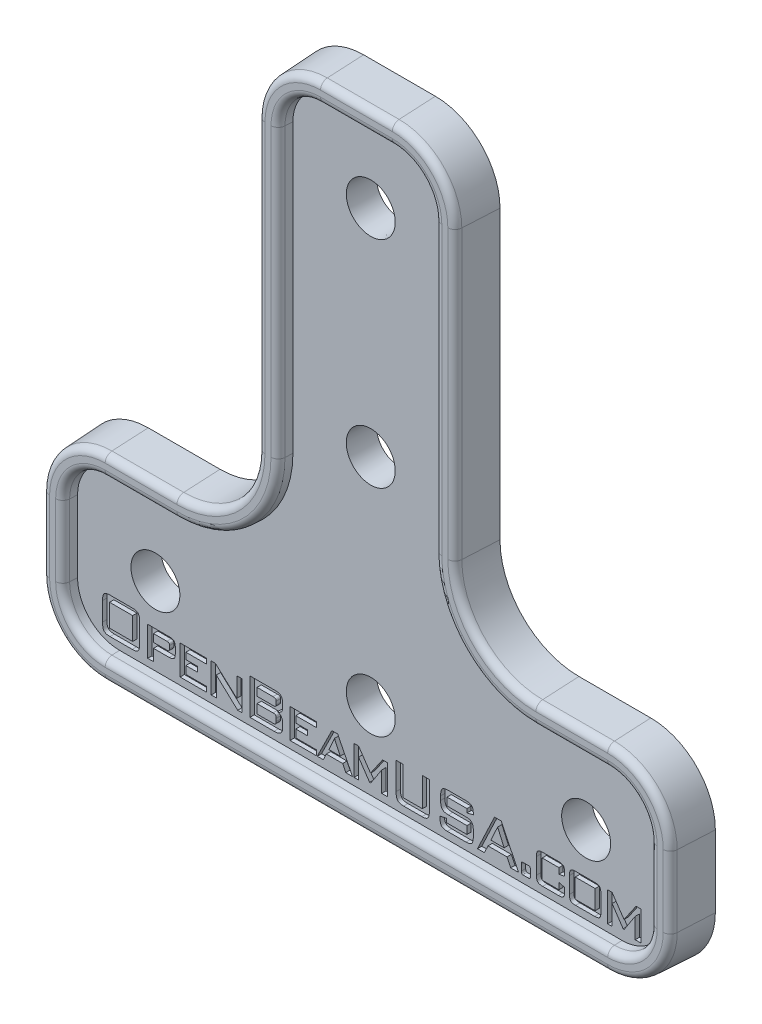
from build123d import *

# Parameters (mm, degrees)
BOSS_EXTRUDE1_DEPTH = 2
FILLET1_R           = 5
SKETCH2_R           = 1.6
CUT_EXTRUDE1_DEPTH  = 38.553295461
MOVE_FACE1_BY       = 0.5
MOVE_FACE1_2_BY     = 0.5
MOVE_FACE1_3_BY     = 0.5
MOVE_FACE1_4_BY     = 0.5
MOVE_FACE1_5_BY     = 0.5
MOVE_FACE1_6_BY     = 0.5
MOVE_FACE1_7_BY     = 0.5
MOVE_FACE1_8_BY     = 0.5
MOVE_FACE1_9_BY     = 0.5
MOVE_FACE1_10_BY    = 0.5
MOVE_FACE1_11_BY    = 0.5
MOVE_FACE1_12_BY    = 0.5
MOVE_FACE1_13_BY    = 0.5
MOVE_FACE1_14_BY    = 0.5
MOVE_FACE1_15_BY    = 0.5
MOVE_FACE1_16_BY    = 0.5
DRAFT1_ANGLE        = -3
BOSS_EXTRUDE3_DEPTH = 1
BOSS_EXTRUDE3_DRAFT = 3
FILLET3_R           = 0.5
CUT_EXTRUDE2_DEPTH  = 0.2
CUT_EXTRUDE2_DRAFT  = -3
SKETCH6_W           = 1.607142857
SKETCH6_H           = 1.5625
SKETCH6_W_2         = 1.383928571
SKETCH6_H_2         = 1.339285714
CUT_EXTRUDE3_DEPTH  = 0.3


with BuildPart() as part:
    # Sketch1 → Boss-Extrude1 (new body)
    with BuildSketch(Plane.XY):
        Polygon((-7.5, 30), (7.5, 30), (7.5, 0), (22.5, 0), (22.5, -15), (-22.5, -15), (-22.5, 0), (-7.5, 0), align=None)
    extrude(amount=BOSS_EXTRUDE1_DEPTH)

    # Fillet1
    fillet1_edges = [part.edges().sort_by_distance(p)[0] for p in [
        (-7.5, 30, 1),
        (7.5, 30, 1),
        (7.5, 0, 1),
        (22.5, 0, 1),
        (22.5, -15, 1),
        (-22.5, -15, 1),
        (-22.5, 0, 1),
        (-7.5, 0, 1),
    ]]
    fillet(fillet1_edges, radius=FILLET1_R)

    # Sketch2 → Cut-Extrude1 (cut, through all)
    with BuildSketch(Plane.XY.offset(2)):
        with Locations((-15, -7.5)):
            Circle(SKETCH2_R)
        with Locations((0, -7.5)):
            Circle(SKETCH2_R)
        with Locations((15, -7.5)):
            Circle(SKETCH2_R)
        with Locations((0, 22.5)):
            Circle(SKETCH2_R)
        with Locations((0, 7.5)):
            Circle(SKETCH2_R)
    extrude(amount=-CUT_EXTRUDE1_DEPTH, mode=Mode.SUBTRACT)

    # Move Face1: a curved face moved inward by 0.5
    add(Solid.thicken(part.faces().sort_by_distance((-8.964466094, 1.464466094, 1))[0], -MOVE_FACE1_BY), mode=Mode.SUBTRACT)

    # Move Face1 2: a face moved inward by 0.5
    extrude(part.faces().sort_by_distance((-15, 0, 1))[0], amount=MOVE_FACE1_2_BY, dir=(0, -1, 0), mode=Mode.SUBTRACT)

    # Move Face1 3: a curved face moved inward by 0.5
    add(Solid.thicken(part.faces().sort_by_distance((-21.035533906, -1.464466094, 1))[0], -MOVE_FACE1_3_BY), mode=Mode.SUBTRACT)

    # Move Face1 4: a face moved inward by 0.5
    extrude(part.faces().sort_by_distance((-22.5, -7.5, 1))[0], amount=MOVE_FACE1_4_BY, dir=(1, 0, 0), mode=Mode.SUBTRACT)

    # Move Face1 5: a curved face moved inward by 0.5
    add(Solid.thicken(part.faces().sort_by_distance((-21.035533906, -13.535533906, 1))[0], -MOVE_FACE1_5_BY), mode=Mode.SUBTRACT)

    # Move Face1 6: a face moved inward by 0.5
    extrude(part.faces().sort_by_distance((0, -15, 1))[0], amount=MOVE_FACE1_6_BY, dir=(0, 1, 0), mode=Mode.SUBTRACT)

    # Move Face1 7: a curved face moved inward by 0.5
    add(Solid.thicken(part.faces().sort_by_distance((21.035533906, -13.535533906, 1))[0], -MOVE_FACE1_7_BY), mode=Mode.SUBTRACT)

    # Move Face1 8: a face moved inward by 0.5
    extrude(part.faces().sort_by_distance((22.5, -7.5, 1))[0], amount=MOVE_FACE1_8_BY, dir=(-1, 0, 0), mode=Mode.SUBTRACT)

    # Move Face1 9: a curved face moved inward by 0.5
    add(Solid.thicken(part.faces().sort_by_distance((21.035533906, -1.464466094, 1))[0], -MOVE_FACE1_9_BY), mode=Mode.SUBTRACT)

    # Move Face1 10: a face moved inward by 0.5
    extrude(part.faces().sort_by_distance((15, 0, 1))[0], amount=MOVE_FACE1_10_BY, dir=(0, -1, 0), mode=Mode.SUBTRACT)

    # Move Face1 11: a curved face moved inward by 0.5
    add(Solid.thicken(part.faces().sort_by_distance((8.964466094, 1.464466094, 1))[0], -MOVE_FACE1_11_BY), mode=Mode.SUBTRACT)

    # Move Face1 12: a face moved inward by 0.5
    extrude(part.faces().sort_by_distance((7.5, 15, 1))[0], amount=MOVE_FACE1_12_BY, dir=(-1, 0, 0), mode=Mode.SUBTRACT)

    # Move Face1 13: a curved face moved inward by 0.5
    add(Solid.thicken(part.faces().sort_by_distance((6.035533906, 28.535533906, 1))[0], -MOVE_FACE1_13_BY), mode=Mode.SUBTRACT)

    # Move Face1 14: a face moved inward by 0.5
    extrude(part.faces().sort_by_distance((0, 30, 1))[0], amount=MOVE_FACE1_14_BY, dir=(0, -1, 0), mode=Mode.SUBTRACT)

    # Move Face1 15: a curved face moved inward by 0.5
    add(Solid.thicken(part.faces().sort_by_distance((-6.035533906, 28.535533906, 1))[0], -MOVE_FACE1_15_BY), mode=Mode.SUBTRACT)

    # Move Face1 16: a face moved inward by 0.5
    extrude(part.faces().sort_by_distance((-7.5, 15, 1))[0], amount=MOVE_FACE1_16_BY, dir=(1, 0, 0), mode=Mode.SUBTRACT)

    # Draft1
    draft1_faces = [part.faces().sort_by_distance(p)[0] for p in [
        (13.4, -7.5, 1),
        (-1.6, 22.5, 1),
        (-1.6, 7.5, 1),
        (-1.6, -7.5, 1),
        (-16.6, -7.5, 1),
        (-20.681980515, -1.818019485, 1),
        (-22, -7.5, 1),
        (-20.681980515, -13.181980515, 1),
        (0, -14.5, 1),
        (20.681980515, -13.181980515, 1),
        (22, -7.5, 1),
        (20.681980515, -1.818019485, 1),
        (15, -0.5, 1),
        (8.610912703, 1.110912703, 1),
        (7, 15, 1),
        (5.681980515, 28.181980515, 1),
        (0, 29.5, 1),
        (-5.681980515, 28.181980515, 1),
        (-7, 15, 1),
        (-8.610912703, 1.110912703, 1),
        (-15, -0.5, 1),
    ]]
    draft(draft1_faces, Plane(origin=(0, 0, 0), x_dir=(-1, 0, 0), z_dir=(0, 0, -1)), DRAFT1_ANGLE)


with BuildPart() as boss_extrude3_tool:
    # Sketch4 → Boss-Extrude3 (with draft: the straight prism first)
    with BuildSketch(Plane.XY.offset(2)):
        with BuildLine():
            Line((-17.5, -14.395184441), (17.5, -14.395184441))
            ThreePointArc((17.5, -14.395184441), (20.607864723, -13.107864723), (21.895184441, -10))
            Line((21.895184441, -10), (21.895184441, -5))
            ThreePointArc((21.895184441, -5), (20.607864723, -1.892135277), (17.5, -0.604815559))
            Line((17.5, -0.604815559), (12.5, -0.604815559))
            ThreePointArc((12.5, -0.604815559), (8.536796911, 1.036796911), (6.895184441, 5))
            Line((6.895184441, 5), (6.895184441, 25))
            ThreePointArc((6.895184441, 25), (5.607864723, 28.107864723), (2.5, 29.395184441))
            Line((2.5, 29.395184441), (-2.5, 29.395184441))
            ThreePointArc((-2.5, 29.395184441), (-5.607864723, 28.107864723), (-6.895184441, 25))
            Line((-6.895184441, 25), (-6.895184441, 5))
            ThreePointArc((-6.895184441, 5), (-8.536796911, 1.036796911), (-12.5, -0.604815559))
            Line((-12.5, -0.604815559), (-17.5, -0.604815559))
            ThreePointArc((-17.5, -0.604815559), (-20.607864723, -1.892135277), (-21.895184441, -5))
            Line((-21.895184441, -5), (-21.895184441, -10))
            ThreePointArc((-21.895184441, -10), (-20.607864723, -13.107864723), (-17.5, -14.395184441))
        make_face()
        with BuildLine():
            Line((-17.5, -12.921388331), (17.5, -12.921388331))
            ThreePointArc((17.5, -12.921388331), (19.565733499, -12.065733499), (20.421388331, -10))
            Line((20.421388331, -10), (20.421388331, -5))
            ThreePointArc((20.421388331, -5), (19.565733499, -2.934266501), (17.5, -2.078611669))
            Line((17.5, -2.078611669), (12.5, -2.078611669))
            ThreePointArc((12.5, -2.078611669), (7.494665688, -0.005334312), (5.421388331, 5))
            Line((5.421388331, 5), (5.421388331, 25))
            ThreePointArc((5.421388331, 25), (4.565733499, 27.065733499), (2.5, 27.921388331))
            Line((2.5, 27.921388331), (-2.5, 27.921388331))
            ThreePointArc((-2.5, 27.921388331), (-4.565733499, 27.065733499), (-5.421388331, 25))
            Line((-5.421388331, 25), (-5.421388331, 5))
            ThreePointArc((-5.421388331, 5), (-7.494665688, -0.005334312), (-12.5, -2.078611669))
            Line((-12.5, -2.078611669), (-17.5, -2.078611669))
            ThreePointArc((-17.5, -2.078611669), (-19.565733499, -2.934266501), (-20.421388331, -5))
            Line((-20.421388331, -5), (-20.421388331, -10))
            ThreePointArc((-20.421388331, -10), (-19.565733499, -12.065733499), (-17.5, -12.921388331))
        make_face(mode=Mode.SUBTRACT)
    extrude(amount=BOSS_EXTRUDE3_DEPTH)
    # Boss-Extrude3: the draft: its side faces are tilted about the plane it starts from
    boss_extrude3_sides = [boss_extrude3_tool.faces().sort_by_distance(p)[0] for p in [
        (-20.607864723, -1.892135277, 2.5),
        (-21.895184441, -7.5, 2.5),
        (-20.607864723, -13.107864723, 2.5),
        (0, -14.395184441, 2.5),
        (20.607864723, -13.107864723, 2.5),
        (21.895184441, -7.5, 2.5),
        (20.607864723, -1.892135277, 2.5),
        (15, -0.604815559, 2.5),
        (8.536796911, 1.036796911, 2.5),
        (6.895184441, 15, 2.5),
        (5.607864723, 28.107864723, 2.5),
        (0, 29.395184441, 2.5),
        (-5.607864723, 28.107864723, 2.5),
        (-6.895184441, 15, 2.5),
        (-8.536796911, 1.036796911, 2.5),
        (-15, -0.604815559, 2.5),
        (-15, -2.078611669, 2.5),
        (-7.494665688, -0.005334312, 2.5),
        (-5.421388331, 15, 2.5),
        (-4.565733499, 27.065733499, 2.5),
        (0, 27.921388331, 2.5),
        (4.565733499, 27.065733499, 2.5),
        (5.421388331, 15, 2.5),
        (7.494665688, -0.005334312, 2.5),
        (15, -2.078611669, 2.5),
        (19.565733499, -2.934266501, 2.5),
        (20.421388331, -7.5, 2.5),
        (19.565733499, -12.065733499, 2.5),
        (0, -12.921388331, 2.5),
        (-19.565733499, -12.065733499, 2.5),
        (-20.421388331, -7.5, 2.5),
        (-19.565733499, -2.934266501, 2.5),
    ]]
    draft(boss_extrude3_sides, Plane.XY.offset(2), BOSS_EXTRUDE3_DRAFT)


with BuildPart() as part_1:
    add(part.part)

    # Boss-Extrude3: add boss_extrude3_tool
    add(boss_extrude3_tool.part)

    # Fillet3
    fillet3_edges = [part_1.edges().sort_by_distance(p)[0] for p in [
        (-20.570806827, -13.070806827, 3),
        (0, -14.342776662, 3),
        (20.570806827, -13.070806827, 3),
        (21.842776662, -7.5, 3),
        (20.570806827, -1.929193173, 3),
        (15, -0.657223338, 3),
        (8.499739015, 0.999739015, 3),
        (6.842776662, 15, 3),
        (5.570806827, 28.070806827, 3),
        (0, 29.342776662, 3),
        (-5.570806827, 28.070806827, 3),
        (-6.842776662, 15, 3),
        (-8.499739015, 0.999739015, 3),
        (-15, -0.657223338, 3),
        (-20.570806827, -1.929193173, 3),
        (-21.842776662, -7.5, 3),
        (-19.602791396, -12.102791396, 3),
        (0, -12.97379611, 3),
        (19.602791396, -12.102791396, 3),
        (20.47379611, -7.5, 3),
        (19.602791396, -2.897208604, 3),
        (15, -2.02620389, 3),
        (7.531723584, 0.031723584, 3),
        (5.47379611, 15, 3),
        (4.602791396, 27.102791396, 3),
        (0, 27.97379611, 3),
        (-4.602791396, 27.102791396, 3),
        (-5.47379611, 15, 3),
        (-7.531723584, 0.031723584, 3),
        (-15, -2.02620389, 3),
        (-19.602791396, -2.897208604, 3),
        (-20.47379611, -7.5, 3),
    ]]
    fillet(fillet3_edges, radius=FILLET3_R)


with BuildPart() as cut_extrude2_tool:
    # Sketch5 → Cut-Extrude2 (with draft: the straight prism first)
    with BuildSketch(Plane(origin=(0, 0, 0), x_dir=(-1, 0, 0), z_dir=(0, 0, -1))):
        with BuildLine():
            Line((-14.5, -13.8), (14.5, -13.8))
            ThreePointArc((14.5, -13.8), (14.853553391, -13.653553391), (15, -13.3))
            Line((15, -13.3), (15, -10.3))
            ThreePointArc((15, -10.3), (14.853553391, -9.946446609), (14.5, -9.8))
            Line((14.5, -9.8), (-14.5, -9.8))
            ThreePointArc((-14.5, -9.8), (-14.853553391, -9.946446609), (-15, -10.3))
            Line((-15, -10.3), (-15, -13.3))
            ThreePointArc((-15, -13.3), (-14.853553391, -13.653553391), (-14.5, -13.8))
        make_face()
    extrude(amount=-CUT_EXTRUDE2_DEPTH)
    # Cut-Extrude2: the draft: its side faces are tilted about the plane it starts from
    cut_extrude2_sides = [cut_extrude2_tool.faces().sort_by_distance(p)[0] for p in [
        (0, -13.8, 0.1),
        (-14.853553391, -13.653553391, 0.1),
        (-15, -11.8, 0.1),
        (-14.853553391, -9.946446609, 0.1),
        (0, -9.8, 0.1),
        (14.853553391, -9.946446609, 0.1),
        (15, -11.8, 0.1),
        (14.853553391, -13.653553391, 0.1),
    ]]
    draft(cut_extrude2_sides, Plane(origin=(0, 0, 0), x_dir=(-1, 0, 0), z_dir=(0, 0, -1)), CUT_EXTRUDE2_DRAFT)


with BuildPart() as part_2:
    add(part_1.part)

    # Cut-Extrude2: cut by cut_extrude2_tool
    add(cut_extrude2_tool.part, mode=Mode.SUBTRACT)

    # Sketch6 → Cut-Extrude3 (cut)
    # profile 1 of 15: a face of its own
    with BuildSketch(Plane.XY.offset(2)):
        with BuildLine():
            add(Edge.make_bspline(
                [(-18.683035714, -10.51011601), (-18.682938002, -10.482896819), (-18.682750693, -10.430719031), (-18.676668044, -10.356042819), (-18.668860697, -10.287926096), (-18.656684431, -10.226526586), (-18.643031263, -10.171215857), (-18.623628363, -10.123356935), (-18.602261682, -10.081592118), (-18.57683028, -10.045679654), (-18.545847467, -10.01549167), (-18.508789269, -9.990400409), (-18.46597857, -9.968617372), (-18.416580048, -9.951568957), (-18.361320255, -9.937537726), (-18.299893333, -9.928095322), (-18.232289845, -9.922620499), (-18.185232384, -9.921811984), (-18.160574777, -9.921388331)],
                knots=[0, 0, 0, 0, 1.403573437, 2.690578007, 3.862923789, 4.937964027, 5.918444779, 6.796020214, 7.595440406, 8.334448064, 9.055422419, 9.814027648, 10.634759978, 11.526322857, 12.50379092, 13.57259004, 14.728063101, 16, 16, 16, 16], degree=3))
            Line((-18.160574777, -9.921388331), (-16.618303571, -9.921388331))
            add(Edge.make_bspline(
                [(-16.618303571, -9.921388331), (-16.593646851, -9.921821445), (-16.546359359, -9.922652086), (-16.47851397, -9.928042886), (-16.416866585, -9.937552288), (-16.361581808, -9.951531158), (-16.312067564, -9.968807094), (-16.268818434, -9.990195221), (-16.231663242, -10.015520924), (-16.200589368, -10.045644028), (-16.175401388, -10.081803336), (-16.152770043, -10.122971899), (-16.134936302, -10.1715459), (-16.119750579, -10.226353255), (-16.108035577, -10.28796068), (-16.100083866, -10.356032245), (-16.094044728, -10.430722068), (-16.09385104, -10.48289786), (-16.09375, -10.51011601)],
                knots=[0, 0, 0, 0, 1.269785572, 2.435237667, 3.502229043, 4.478043838, 5.368098746, 6.198135559, 6.9554577, 7.675212615, 8.41297033, 9.216677895, 10.088421144, 11.070387939, 12.143609877, 13.313972779, 14.598800537, 16, 16, 16, 16], degree=3))
            Line((-16.09375, -10.51011601), (-16.09375, -11.811036769))
            add(Edge.make_bspline(
                [(-16.09375, -11.811036769), (-16.093842278, -11.839417739), (-16.09401872, -11.893684241), (-16.100160957, -11.971615929), (-16.107923834, -12.042494992), (-16.119768025, -12.106636793), (-16.134983627, -12.163512713), (-16.152647685, -12.213987832), (-16.175226782, -12.256626432), (-16.200584268, -12.293600425), (-16.231614851, -12.324447097), (-16.268765478, -12.35050105), (-16.312034652, -12.372539497), (-16.361440049, -12.390711436), (-16.416882029, -12.404519647), (-16.478547615, -12.413833116), (-16.546317858, -12.420380788), (-16.593639586, -12.421043123), (-16.618303571, -12.421388331)],
                knots=[0, 0, 0, 0, 1.431764632, 2.737639174, 3.942781974, 5.02906717, 6.025299976, 6.912532689, 7.72083079, 8.453349384, 9.16691991, 9.91579719, 10.734504626, 11.610727997, 12.566975227, 13.612570717, 14.755676853, 16, 16, 16, 16], degree=3))
            Line((-16.618303571, -12.421388331), (-18.160574777, -12.421388331))
            add(Edge.make_bspline(
                [(-18.160574777, -12.421388331), (-18.185239843, -12.421053786), (-18.232332055, -12.420415051), (-18.299858951, -12.413778337), (-18.36130513, -12.404534983), (-18.416721056, -12.39067324), (-18.466016648, -12.372733543), (-18.508837175, -12.350292386), (-18.545896228, -12.324476536), (-18.576835987, -12.293565989), (-18.602437267, -12.256831275), (-18.623739569, -12.213611433), (-18.642993476, -12.163833364), (-18.656664691, -12.106469119), (-18.668974999, -12.042529082), (-18.676590443, -11.971605588), (-18.682776858, -11.893687213), (-18.682946824, -11.83941876), (-18.683035714, -11.811036769)],
                knots=[0, 0, 0, 0, 1.246375741, 2.37966474, 3.42698501, 4.384809634, 5.262478393, 6.072109836, 6.82222244, 7.536970048, 8.27069698, 9.074935671, 9.967741802, 10.962637047, 12.050714143, 13.257844907, 14.565873577, 16, 16, 16, 16], degree=3))
            Line((-18.683035714, -11.811036769), (-18.683035714, -10.51011601))
        make_face()
        with Locations((-17.388392858, -11.149066903)):
            Rectangle(SKETCH6_W, SKETCH6_H, mode=Mode.SUBTRACT)
    # profile 2 of 15: a face of its own
    with BuildSketch(Plane.XY.offset(2)):
        with BuildLine():
            Line((-15.535714286, -12.421388331), (-15.535714286, -10.367816903))
            Line((-15.535714286, -10.367816903), (-14.029715402, -10.367816903))
            add(Edge.make_bspline(
                [(-14.029715402, -10.367816903), (-13.995423097, -10.368539056), (-13.931618582, -10.369882701), (-13.843548193, -10.388389773), (-13.76975323, -10.416602804), (-13.710808728, -10.459570634), (-13.666606985, -10.516609772), (-13.63694694, -10.588263693), (-13.619168575, -10.67387452), (-13.617150642, -10.735791272), (-13.616071429, -10.768905072)],
                knots=[0, 0, 0, 0, 1.229947315, 2.288449038, 3.21776736, 4.048244043, 4.875520742, 5.777278643, 6.811262717, 8, 8, 8, 8], degree=3))
            Line((-13.616071429, -10.768905072), (-13.616071429, -11.216728733))
            add(Edge.make_bspline(
                [(-13.616071429, -11.216728733), (-13.61713941, -11.249840567), (-13.619129003, -11.311526162), (-13.637004149, -11.397243648), (-13.667259143, -11.468686782), (-13.711509006, -11.52635012), (-13.770938209, -11.568616699), (-13.844372756, -11.597454165), (-13.932113653, -11.615653184), (-13.995666115, -11.617062069), (-14.029715402, -11.617816903)],
                knots=[0, 0, 0, 0, 1.189703839, 2.216355318, 3.129857055, 3.957806409, 4.795702339, 5.718039216, 6.7774016, 8, 8, 8, 8], degree=3))
            Line((-14.029715402, -11.617816903), (-15.133928571, -11.617816903))
            Line((-15.133928571, -11.617816903), (-15.133928571, -12.421388331))
            Line((-15.133928571, -12.421388331), (-15.535714286, -12.421388331))
        make_face()
        with BuildLine():
            Line((-14.203404018, -10.72495976), (-15.133928571, -10.72495976))
            Line((-15.133928571, -10.72495976), (-15.133928571, -11.260674045))
            Line((-15.133928571, -11.260674045), (-14.203404018, -11.260674045))
            add(Edge.make_bspline(
                [(-14.203404018, -11.260674045), (-14.187098835, -11.260411914), (-14.157096885, -11.259929586), (-14.115874448, -11.253123203), (-14.082698889, -11.241865943), (-14.056496441, -11.22503593), (-14.038862603, -11.201230006), (-14.025790126, -11.172314024), (-14.019621299, -11.136752914), (-14.018473493, -11.11118051), (-14.017857143, -11.097448599)],
                knots=[0, 0, 0, 0, 1.352116432, 2.487928597, 3.45245427, 4.244622693, 5.028283095, 5.874769735, 6.858790467, 8, 8, 8, 8], degree=3))
            Line((-14.017857143, -11.097448599), (-14.017857143, -10.888185206))
            add(Edge.make_bspline(
                [(-14.017857143, -10.888185206), (-14.018466943, -10.874447349), (-14.01960255, -10.848863871), (-14.025849613, -10.813373783), (-14.038604854, -10.784405633), (-14.05696494, -10.76134583), (-14.082395639, -10.743581231), (-14.115935147, -10.732589069), (-14.157077073, -10.725678609), (-14.187091859, -10.725212873), (-14.203404018, -10.72495976)],
                knots=[0, 0, 0, 0, 1.141800926, 2.126331593, 2.973256896, 3.742199929, 4.545756613, 5.510782118, 6.64718288, 8, 8, 8, 8], degree=3))
        make_face(mode=Mode.SUBTRACT)
    # profile 3 of 15: a face of its own
    with BuildSketch(Plane.XY.offset(2)):
        Polygon((-13.28125, -12.421388331), (-13.28125, -10.367816903), (-11.450892857, -10.367816903), (-11.450892857, -10.72495976), (-12.879464286, -10.72495976), (-12.879464286, -11.171388331), (-12.075892857, -11.171388331), (-12.075892857, -11.528531188), (-12.879464286, -11.528531188), (-12.879464286, -12.064245474), (-11.450892857, -12.064245474), (-11.450892857, -12.421388331), align=None)
    # profile 4 of 15: a face of its own
    with BuildSketch(Plane.XY.offset(2)):
        Polygon((-11.116071429, -12.421388331), (-11.116071429, -10.367816903), (-10.821707589, -10.367816903), (-9.330357143, -11.731516679), (-9.330357143, -10.367816903), (-8.973214286, -10.367816903), (-8.973214286, -12.421388331), (-9.269670759, -12.421388331), (-10.758928571, -11.036762215), (-10.758928571, -12.421388331), align=None)
    # profile 5 of 15: a face of its own
    with BuildSketch(Plane.XY.offset(2)):
        with BuildLine():
            Line((-8.415178571, -12.421388331), (-8.415178571, -9.921388331))
            Line((-8.415178571, -9.921388331), (-6.604352679, -9.921388331))
            add(Edge.make_bspline(
                [(-6.604352679, -9.921388331), (-6.584578843, -9.921834875), (-6.546344475, -9.922698306), (-6.490993159, -9.928039701), (-6.439967327, -9.937982556), (-6.392984602, -9.950745963), (-6.350485334, -9.96859511), (-6.312122888, -9.989884555), (-6.278270641, -10.015636971), (-6.247499297, -10.044225626), (-6.221859971, -10.078333565), (-6.199342826, -10.116212883), (-6.180626562, -10.158719559), (-6.16430305, -10.205449169), (-6.152784019, -10.257462736), (-6.1448266, -10.313921043), (-6.13872257, -10.37466268), (-6.138505034, -10.416628349), (-6.138392857, -10.438268911)],
                knots=[0, 0, 0, 0, 1.179053587, 2.27979888, 3.310209753, 4.275627239, 5.176695408, 6.051906754, 6.883661987, 7.707291014, 8.547436998, 9.417583548, 10.329674368, 11.311670144, 12.364223081, 13.499348066, 14.710481303, 16, 16, 16, 16], degree=3))
            Line((-6.138392857, -10.438268911), (-6.138392857, -10.712403956))
            add(Edge.make_bspline(
                [(-6.138392857, -10.712403956), (-6.139201585, -10.740664602), (-6.140751158, -10.794813763), (-6.159801787, -10.871364096), (-6.188653758, -10.939999278), (-6.231476997, -10.9984646), (-6.284875183, -11.04779488), (-6.349361396, -11.086101447), (-6.424010981, -11.11446387), (-6.477873721, -11.124365422), (-6.505998884, -11.129535653)],
                knots=[0, 0, 0, 0, 1.098733523, 2.105242008, 3.054667811, 3.982622784, 4.906010345, 5.869427447, 6.887492557, 8, 8, 8, 8], degree=3))
            add(Edge.make_bspline(
                [(-6.505998884, -11.129535653), (-6.478036354, -11.135503517), (-6.424069928, -11.147021228), (-6.349494996, -11.180530422), (-6.285840082, -11.227562783), (-6.231981261, -11.286146859), (-6.190215279, -11.356411535), (-6.158931917, -11.436113578), (-6.142041656, -11.526206522), (-6.139644104, -11.589151907), (-6.138392857, -11.62200217)],
                knots=[0, 0, 0, 0, 1.013460027, 1.955932307, 2.877588656, 3.806945104, 4.76292404, 5.764334755, 6.833239427, 8, 8, 8, 8], degree=3))
            Line((-6.138392857, -11.62200217), (-6.138392857, -11.935199715))
            add(Edge.make_bspline(
                [(-6.138392857, -11.935199715), (-6.138719134, -11.95521589), (-6.1393511, -11.993985259), (-6.146352988, -12.050089823), (-6.158290901, -12.101885834), (-6.174184983, -12.150022339), (-6.195462804, -12.19402501), (-6.220131016, -12.234909748), (-6.250938229, -12.270878361), (-6.285794672, -12.303013122), (-6.32562112, -12.331371608), (-6.370173139, -12.355556185), (-6.41960395, -12.375811734), (-6.47355595, -12.392422759), (-6.532276629, -12.405800235), (-6.595779264, -12.414401622), (-6.66400309, -12.420183393), (-6.71106383, -12.420976607), (-6.735491071, -12.421388331)],
                knots=[0, 0, 0, 0, 1.08782081, 2.107002258, 3.066832627, 3.974287218, 4.856380914, 5.719335199, 6.562621095, 7.421491684, 8.291454475, 9.213583009, 10.171413382, 11.190986747, 12.279688622, 13.441734262, 14.672112383, 16, 16, 16, 16], degree=3))
            Line((-6.735491071, -12.421388331), (-8.415178571, -12.421388331))
        make_face()
        with BuildLine():
            Line((-6.809430804, -10.367816903), (-7.924107143, -10.367816903))
            Line((-7.924107143, -10.367816903), (-7.924107143, -10.903531188))
            Line((-7.924107143, -10.903531188), (-6.809430804, -10.903531188))
            add(Edge.make_bspline(
                [(-6.809430804, -10.903531188), (-6.789868986, -10.903287406), (-6.753850642, -10.902838541), (-6.704705771, -10.895868934), (-6.664727575, -10.885532078), (-6.633451466, -10.869144346), (-6.610525171, -10.846199776), (-6.594844818, -10.816925235), (-6.585991347, -10.781273052), (-6.585228551, -10.755471654), (-6.584821429, -10.741700831)],
                knots=[0, 0, 0, 0, 1.458061766, 2.684667078, 3.694961047, 4.525618309, 5.286113602, 6.078010599, 6.974188284, 8, 8, 8, 8], degree=3))
            Line((-6.584821429, -10.741700831), (-6.584821429, -10.52964726))
            add(Edge.make_bspline(
                [(-6.584821429, -10.52964726), (-6.585215601, -10.516102183), (-6.585953486, -10.490746024), (-6.594997769, -10.455637651), (-6.610492176, -10.426504554), (-6.633624093, -10.40365479), (-6.664600507, -10.386469448), (-6.704601516, -10.375280427), (-6.753863487, -10.36857796), (-6.789873506, -10.368084762), (-6.809430804, -10.367816903)],
                knots=[0, 0, 0, 0, 1.011123078, 1.892805606, 2.686758123, 3.449227428, 4.290532683, 5.308364354, 6.538153555, 8, 8, 8, 8], degree=3))
        make_face(mode=Mode.SUBTRACT)
        with BuildLine():
            Line((-6.809430804, -11.34995976), (-7.924107143, -11.34995976))
            Line((-7.924107143, -11.34995976), (-7.924107143, -11.97495976))
            Line((-7.924107143, -11.97495976), (-6.809430804, -11.97495976))
            add(Edge.make_bspline(
                [(-6.809430804, -11.97495976), (-6.78912971, -11.974729537), (-6.751959866, -11.974308016), (-6.701848603, -11.964050408), (-6.661008099, -11.950556293), (-6.630050641, -11.927619568), (-6.609123919, -11.895827935), (-6.594863374, -11.856463039), (-6.585878103, -11.808409349), (-6.585191715, -11.773414396), (-6.584821429, -11.754535653)],
                knots=[0, 0, 0, 0, 1.312342557, 2.402804986, 3.304020979, 4.078546667, 4.847629795, 5.734752509, 6.777965855, 8, 8, 8, 8], degree=3))
            Line((-6.584821429, -11.754535653), (-6.584821429, -11.568291233))
            add(Edge.make_bspline(
                [(-6.584821429, -11.568291233), (-6.585200764, -11.549416114), (-6.585903926, -11.514427881), (-6.594743125, -11.466546068), (-6.609130884, -11.427679287), (-6.630070466, -11.396444881), (-6.661397726, -11.374656265), (-6.701546197, -11.359680216), (-6.752105393, -11.35100656), (-6.789165763, -11.350329813), (-6.809430804, -11.34995976)],
                knots=[0, 0, 0, 0, 1.227068129, 2.274578833, 3.151237288, 3.911086288, 4.679771909, 5.590123259, 6.682251448, 8, 8, 8, 8], degree=3))
        make_face(mode=Mode.SUBTRACT)
    # profile 6 of 15: a face of its own
    with BuildSketch(Plane.XY.offset(2)):
        Polygon((-5.625, -12.421388331), (-5.625, -10.367816903), (-3.794642857, -10.367816903), (-3.794642857, -10.72495976), (-5.223214286, -10.72495976), (-5.223214286, -11.171388331), (-4.419642857, -11.171388331), (-4.419642857, -11.528531188), (-5.223214286, -11.528531188), (-5.223214286, -12.064245474), (-3.794642857, -12.064245474), (-3.794642857, -12.421388331), align=None)
    # profile 7 of 15: a face of its own
    with BuildSketch(Plane.XY.offset(2)):
        Polygon((-3.727678571, -12.421388331), (-2.709263393, -10.367816903), (-2.306780134, -10.367816903), (-1.272321429, -12.421388331), (-1.741768973, -12.421388331), (-1.958007812, -11.97495976), (-3.093610491, -11.97495976), (-3.30984933, -12.421388331), align=None)
        Polygon((-2.915039062, -11.617816903), (-2.128208705, -11.617816903), (-2.52859933, -10.746583644), align=None, mode=Mode.SUBTRACT)
    # profile 8 of 15: a face of its own
    with BuildSketch(Plane.XY.offset(2)):
        Polygon((-1.160714286, -12.421388331), (-1.160714286, -10.367816903), (-0.848214286, -10.367816903), (-0.017438616, -11.586427394), (0.822405134, -10.367816903), (1.160714286, -10.367816903), (1.160714286, -12.421388331), (0.758928571, -12.421388331), (0.758928571, -11.008162885), (0.000697545, -12.174457528), (-0.080217634, -12.174457528), (-0.848214286, -11.040947483), (-0.848214286, -12.421388331), align=None)
    # profile 9 of 15: a face of its own
    with BuildSketch(Plane.XY.offset(2)):
        with BuildLine():
            Line((2.254464286, -9.921388331), (2.254464286, -11.930316903))
            Line((2.254464286, -11.930316903), (3.59375, -11.930316903))
            Line((3.59375, -11.930316903), (3.59375, -9.921388331))
            Line((3.59375, -9.921388331), (4.084821429, -9.921388331))
            Line((4.084821429, -9.921388331), (4.084821429, -11.811036769))
            add(Edge.make_bspline(
                [(4.084821429, -11.811036769), (4.084729151, -11.83941774), (4.08455271, -11.893684242), (4.078410469, -11.971615924), (4.070647603, -12.042495008), (4.058803376, -12.106636741), (4.043587889, -12.163512882), (4.025923466, -12.213987296), (4.003345545, -12.256628171), (3.977984177, -12.293594652), (3.946967658, -12.32446853), (3.909930317, -12.35029481), (3.867103299, -12.37273261), (3.817809766, -12.390674382), (3.762392801, -12.404530974), (3.700719574, -12.413829665), (3.632951625, -12.420381775), (3.585629562, -12.421043461), (3.560965402, -12.421388331)],
                knots=[0, 0, 0, 0, 1.432696721, 2.739421396, 3.945348753, 5.032341128, 6.029222489, 6.917032796, 7.725857105, 8.458852573, 9.172887639, 9.922252443, 10.731076752, 11.60787055, 12.564740304, 13.611016484, 14.75486679, 16, 16, 16, 16], degree=3))
            Line((3.560965402, -12.421388331), (2.28515625, -12.421388331))
            add(Edge.make_bspline(
                [(2.28515625, -12.421388331), (2.260725019, -12.421041479), (2.213867868, -12.420376245), (2.146787965, -12.413857345), (2.085611417, -12.404422129), (2.030586419, -12.390821903), (1.981612193, -12.372601766), (1.938902995, -12.350085944), (1.901310533, -12.324703811), (1.870249293, -12.29356777), (1.844862961, -12.25663627), (1.822292601, -12.2139848), (1.804625834, -12.16351367), (1.789411083, -12.106636498), (1.777566629, -12.042495084), (1.769803833, -11.971615901), (1.763661571, -11.893684249), (1.763485133, -11.839417742), (1.763392857, -11.811036769)],
                knots=[0, 0, 0, 0, 1.23621022, 2.370952548, 3.407995083, 4.367048021, 5.234819768, 6.045489481, 6.806183598, 7.521847799, 8.256515662, 9.067185375, 9.957021301, 10.956177136, 12.045649581, 13.254328369, 14.564034454, 16, 16, 16, 16], degree=3))
            Line((1.763392857, -11.811036769), (1.763392857, -9.921388331))
            Line((1.763392857, -9.921388331), (2.254464286, -9.921388331))
        make_face()
    # profile 10 of 15: a face of its own
    with BuildSketch(Plane.XY.offset(2)):
        with BuildLine():
            Line((6.696428571, -10.367816903), (5.3125, -10.367816903))
            Line((5.3125, -10.367816903), (5.3125, -10.903531188))
            Line((5.3125, -10.903531188), (6.63016183, -10.903531188))
            add(Edge.make_bspline(
                [(6.63016183, -10.903531188), (6.654353014, -10.903958949), (6.700479225, -10.904774577), (6.766713326, -10.910183332), (6.826905144, -10.919870583), (6.881304458, -10.93330079), (6.92929363, -10.951844001), (6.971690494, -10.973066465), (7.007619207, -10.999097146), (7.038065694, -11.029410299), (7.063642091, -11.06526319), (7.084974932, -11.107481732), (7.103195036, -11.156136605), (7.117397219, -11.211638562), (7.129343814, -11.273803544), (7.137366908, -11.3428083), (7.142315022, -11.418477621), (7.142671297, -11.471091459), (7.142857143, -11.498536769)],
                knots=[0, 0, 0, 0, 1.251664019, 2.386593346, 3.434812074, 4.403525499, 5.279339231, 6.091802716, 6.849802477, 7.564361493, 8.305564064, 9.118027549, 10.005088541, 10.988481401, 12.078528828, 13.278238635, 14.580229349, 16, 16, 16, 16], degree=3))
            Line((7.142857143, -11.498536769), (7.142857143, -11.820802394))
            add(Edge.make_bspline(
                [(7.142857143, -11.820802394), (7.142670907, -11.848480082), (7.142313758, -11.90155824), (7.137365743, -11.977924663), (7.1293358, -12.047622044), (7.117402599, -12.110490083), (7.103150126, -12.166658376), (7.085162413, -12.215888413), (7.063443653, -12.258367141), (7.038074605, -12.294750102), (7.0078556, -12.325841034), (6.971643631, -12.351775421), (6.929450865, -12.373242409), (6.881137779, -12.390741413), (6.826858606, -12.40421072), (6.766788679, -12.414980112), (6.70046859, -12.42007351), (6.654349355, -12.420935995), (6.63016183, -12.421388331)],
                knots=[0, 0, 0, 0, 1.424071459, 2.730975543, 3.936089492, 5.032008831, 6.021662612, 6.915142695, 7.723221153, 8.470166276, 9.189379185, 9.94328787, 10.751366328, 11.61825191, 12.581736995, 13.626287574, 14.755091461, 16, 16, 16, 16], degree=3))
            Line((6.63016183, -12.421388331), (5.324358259, -12.421388331))
            add(Edge.make_bspline(
                [(5.324358259, -12.421388331), (5.300866876, -12.420931359), (5.255674503, -12.420052242), (5.190533843, -12.414925726), (5.131530179, -12.404487117), (5.078393092, -12.390307101), (5.030932807, -12.373619972), (4.989668753, -12.35157881), (4.954294363, -12.325618915), (4.924073733, -12.294956748), (4.899449082, -12.258298175), (4.878544743, -12.215717937), (4.860436506, -12.166672042), (4.845991982, -12.110563995), (4.835216036, -12.047531968), (4.826837919, -11.97793932), (4.821995382, -11.901554055), (4.821622836, -11.848478648), (4.821428571, -11.820802394)],
                knots=[0, 0, 0, 0, 1.219667072, 2.346377425, 3.388230707, 4.325160294, 5.199674189, 5.993493179, 6.744299279, 7.46984103, 8.21646325, 9.026182912, 9.927525331, 10.925887746, 12.029274189, 13.244992753, 14.563397171, 16, 16, 16, 16], degree=3))
            Line((4.821428571, -11.820802394), (4.821428571, -11.75872092))
            Line((4.821428571, -11.75872092), (5.267857143, -11.66245976))
            Line((5.267857143, -11.66245976), (5.267857143, -11.930316903))
            Line((5.267857143, -11.930316903), (6.696428571, -11.930316903))
            Line((6.696428571, -11.930316903), (6.696428571, -11.394602617))
            Line((6.696428571, -11.394602617), (5.406668527, -11.394602617))
            add(Edge.make_bspline(
                [(5.406668527, -11.394602617), (5.381318621, -11.394142187), (5.332646449, -11.393258156), (5.262625271, -11.38820715), (5.199039968, -11.377517598), (5.141836488, -11.363824902), (5.090670769, -11.346784404), (5.046603427, -11.324170198), (5.008215836, -11.298389637), (4.97572848, -11.267778264), (4.949636871, -11.230568829), (4.926561464, -11.188113753), (4.907738712, -11.138304217), (4.89305814, -11.081840424), (4.880014688, -11.018833425), (4.872516201, -10.948772379), (4.866340152, -10.872018433), (4.86616349, -10.818446253), (4.866071429, -10.790528956)],
                knots=[0, 0, 0, 0, 1.269118906, 2.436725934, 3.510156791, 4.492522834, 5.379601377, 6.202018549, 6.963898946, 7.688320218, 8.421662355, 9.228867506, 10.102094215, 11.078998209, 12.147242463, 13.319481032, 14.603139802, 16, 16, 16, 16], degree=3))
            Line((4.866071429, -10.790528956), (4.866071429, -10.512906188))
            add(Edge.make_bspline(
                [(4.866071429, -10.512906188), (4.866168727, -10.485686466), (4.866356072, -10.43327569), (4.872507781, -10.358146186), (4.880016723, -10.289478223), (4.89301151, -10.227844707), (4.907893802, -10.172615002), (4.926346791, -10.123783283), (4.949852356, -10.082499353), (4.975700358, -10.04602468), (5.008481655, -10.016282414), (5.046389433, -9.990260801), (5.090887408, -9.968693775), (5.141807749, -9.951449339), (5.198979833, -9.937581032), (5.262701901, -9.928047641), (5.332635014, -9.922656793), (5.381314705, -9.921822734), (5.406668527, -9.921388331)],
                knots=[0, 0, 0, 0, 1.377632593, 2.652591195, 3.814954431, 4.872421982, 5.83787301, 6.710181857, 7.506051987, 8.238342604, 8.963022824, 9.733676968, 10.56030012, 11.457594181, 12.451273063, 13.535212947, 14.716266034, 16, 16, 16, 16], degree=3))
            Line((5.406668527, -9.921388331), (6.606445313, -9.921388331))
            add(Edge.make_bspline(
                [(6.606445313, -9.921388331), (6.630871508, -9.921807846), (6.677930234, -9.92261607), (6.745479683, -9.928236239), (6.807133727, -9.936888325), (6.862778268, -9.950065049), (6.91249593, -9.967560204), (6.956687775, -9.988232319), (6.995178384, -10.012838845), (7.027760105, -10.041925314), (7.055736906, -10.075759055), (7.07966266, -10.115155119), (7.098382083, -10.160900236), (7.115935242, -10.211649019), (7.127570867, -10.2686675), (7.13703729, -10.331263883), (7.141354413, -10.399846619), (7.142342132, -10.447566677), (7.142857143, -10.472448599)],
                knots=[0, 0, 0, 0, 1.296779316, 2.498333482, 3.59650498, 4.599589076, 5.528850417, 6.390279385, 7.1847031, 7.945414428, 8.699384315, 9.508162524, 10.381888205, 11.318826147, 12.355238386, 13.465624049, 14.678540085, 16, 16, 16, 16], degree=3))
            Line((7.142857143, -10.472448599), (7.142857143, -10.521974269))
            Line((7.142857143, -10.521974269), (6.696428571, -10.635674045))
            Line((6.696428571, -10.635674045), (6.696428571, -10.367816903))
        make_face()
    # profile 11 of 15: a face of its own
    with BuildSketch(Plane.XY.offset(2)):
        Polygon((7.433035714, -12.421388331), (8.618861607, -9.921388331), (9.088309152, -9.921388331), (10.290178571, -12.421388331), (9.742606027, -12.421388331), (9.490792411, -11.885674045), (8.162667411, -11.885674045), (7.918526786, -12.421388331), align=None)
        Polygon((8.370535714, -11.439245474), (9.289202009, -11.439245474), (8.836495536, -10.41106467), align=None, mode=Mode.SUBTRACT)
    # profile 12 of 15: a face of its own
    with BuildSketch(Plane.XY.offset(2)):
        with BuildLine():
            Line((10.947265625, -11.66245976), (11.019810268, -11.66245976))
            add(Edge.make_bspline(
                [(11.019810268, -11.66245976), (11.027999823, -11.662762392), (11.043561673, -11.663337456), (11.065175956, -11.670328563), (11.08258162, -11.682608663), (11.096133093, -11.700261925), (11.105761925, -11.72423938), (11.111339898, -11.756185192), (11.115503699, -11.796046072), (11.115871855, -11.825669926), (11.116071429, -11.841728733)],
                knots=[0, 0, 0, 0, 0.842748251, 1.601396187, 2.306979553, 3.007651606, 3.867638522, 4.945078856, 6.343956529, 8, 8, 8, 8], degree=3))
            Line((11.116071429, -11.841728733), (11.116071429, -12.239329179))
            add(Edge.make_bspline(
                [(11.116071429, -12.239329179), (11.115821061, -12.256762807), (11.115366151, -12.28843915), (11.111889735, -12.331172221), (11.104495153, -12.363489524), (11.094282293, -12.38903526), (11.072304395, -12.405401944), (11.040731236, -12.414780928), (10.997929358, -12.420548374), (10.965425103, -12.421087264), (10.947265625, -12.421388331)],
                knots=[0, 0, 0, 0, 1.374312623, 2.49708187, 3.363450868, 3.994280748, 4.60648522, 5.440693098, 6.570166394, 8, 8, 8, 8], degree=3))
            Line((10.947265625, -12.421388331), (10.587332589, -12.421388331))
            add(Edge.make_bspline(
                [(10.587332589, -12.421388331), (10.57911215, -12.421167543), (10.563414316, -12.420745924), (10.542130949, -12.412637095), (10.524295868, -12.400562189), (10.511071218, -12.382066531), (10.501375174, -12.357518538), (10.495874648, -12.325085057), (10.491623159, -12.285016668), (10.491265378, -12.255389684), (10.491071429, -12.239329179)],
                knots=[0, 0, 0, 0, 0.835167186, 1.594843724, 2.294079912, 3.007322222, 3.881508909, 4.972559845, 6.35885371, 8, 8, 8, 8], degree=3))
            Line((10.491071429, -12.239329179), (10.491071429, -11.841728733))
            add(Edge.make_bspline(
                [(10.491071429, -11.841728733), (10.491185364, -11.824740543), (10.491393545, -11.793700027), (10.496404974, -11.752132698), (10.502580946, -11.720057916), (10.512899367, -11.694820591), (10.534824102, -11.678443275), (10.566417608, -11.66906836), (10.609211296, -11.663299276), (10.641716965, -11.662760669), (10.659877232, -11.66245976)],
                knots=[0, 0, 0, 0, 1.350323658, 2.467287249, 3.319663914, 3.956451267, 4.574437317, 5.416523344, 6.556663236, 8, 8, 8, 8], degree=3))
            Line((10.659877232, -11.66245976), (10.947265625, -11.66245976))
        make_face()
    # profile 13 of 15: a face of its own
    with BuildSketch(Plane.XY.offset(2)):
        with BuildLine():
            Line((13.102678571, -10.72495976), (11.941964286, -10.72495976))
            Line((11.941964286, -10.72495976), (11.941964286, -12.064245474))
            Line((11.941964286, -12.064245474), (13.102678571, -12.064245474))
            Line((13.102678571, -12.064245474), (13.102678571, -11.617816903))
            Line((13.102678571, -11.617816903), (13.504464286, -11.722448599))
            Line((13.504464286, -11.722448599), (13.504464286, -11.969379403))
            add(Edge.make_bspline(
                [(13.504464286, -11.969379403), (13.504225172, -11.99031379), (13.503767671, -12.030368003), (13.499538173, -12.087890357), (13.492809609, -12.140119142), (13.483089798, -12.187249575), (13.470674771, -12.229345752), (13.455367521, -12.266587161), (13.437475812, -12.298982546), (13.416006342, -12.326280927), (13.390638211, -12.349459178), (13.360454884, -12.368951717), (13.324722096, -12.384775243), (13.284478926, -12.398826014), (13.238845531, -12.409156136), (13.188372016, -12.415523408), (13.133019472, -12.42096738), (13.094324134, -12.421243742), (13.074079241, -12.421388331)],
                knots=[0, 0, 0, 0, 1.360765523, 2.603581789, 3.747306032, 4.781943921, 5.72883076, 6.59625079, 7.394964774, 8.126798441, 8.843648472, 9.619286352, 10.451209517, 11.378590932, 12.386946235, 13.485736962, 14.684570554, 16, 16, 16, 16], degree=3))
            Line((13.074079241, -12.421388331), (11.970563616, -12.421388331))
            add(Edge.make_bspline(
                [(11.970563616, -12.421388331), (11.950549924, -12.42124209), (11.912084521, -12.420961022), (11.856984992, -12.415470427), (11.806665401, -12.409356954), (11.761551407, -12.39839222), (11.720947492, -12.385904984), (11.685973126, -12.368663788), (11.655154862, -12.350065383), (11.629357164, -12.327183074), (11.608057071, -12.299789611), (11.589907352, -12.267712714), (11.573808753, -12.230902429), (11.561508239, -12.188410569), (11.551909277, -12.141036864), (11.545049193, -12.088360305), (11.54090514, -12.03059785), (11.540427022, -11.990313077), (11.540178571, -11.969379403)],
                knots=[0, 0, 0, 0, 1.300519112, 2.499538489, 3.598499497, 4.592285813, 5.514993242, 6.353475823, 7.121088848, 7.849279118, 8.581226198, 9.366937809, 10.240399869, 11.187433448, 12.237034841, 13.380936328, 14.639023597, 16, 16, 16, 16], degree=3))
            Line((11.540178571, -11.969379403), (11.540178571, -10.837961992))
            add(Edge.make_bspline(
                [(11.540178571, -10.837961992), (11.540422204, -10.816098457), (11.540889224, -10.774188029), (11.545065512, -10.714104152), (11.551870055, -10.659572367), (11.561506034, -10.610324339), (11.574107257, -10.566555521), (11.588257803, -10.527526537), (11.606558719, -10.494498), (11.627901872, -10.466197347), (11.653921957, -10.442729532), (11.68429251, -10.422481892), (11.719549987, -10.404794403), (11.760006942, -10.391269143), (11.805577273, -10.380746102), (11.855985006, -10.373509516), (11.911630113, -10.368294661), (11.950321034, -10.367981004), (11.970563616, -10.367816903)],
                knots=[0, 0, 0, 0, 1.39109117, 2.6665966, 3.830090744, 4.8862859, 5.85570128, 6.726752594, 7.521451052, 8.24944347, 8.972003032, 9.739374419, 10.566467661, 11.474192602, 12.446764227, 13.53902846, 14.712451967, 16, 16, 16, 16], degree=3))
            Line((11.970563616, -10.367816903), (13.074079241, -10.367816903))
            add(Edge.make_bspline(
                [(13.074079241, -10.367816903), (13.094320271, -10.367993748), (13.133239923, -10.368333788), (13.189135039, -10.373430511), (13.239961834, -10.380881004), (13.285640939, -10.391011083), (13.325975095, -10.404954297), (13.361014064, -10.42250702), (13.391407177, -10.442496183), (13.416732766, -10.466453594), (13.438117203, -10.494462429), (13.45637492, -10.527537438), (13.470538766, -10.566552115), (13.483135852, -10.610325384), (13.492773102, -10.659572045), (13.499577253, -10.714104251), (13.503753659, -10.774188), (13.504220663, -10.816098448), (13.504464286, -10.837961992)],
                knots=[0, 0, 0, 0, 1.287198977, 2.475038841, 3.56700696, 4.553721921, 5.44723032, 6.274099336, 7.041262687, 7.752792964, 8.480588023, 9.275071037, 10.145886208, 11.115038778, 12.170947598, 13.334126317, 14.609285957, 16, 16, 16, 16], degree=3))
            Line((13.504464286, -10.837961992), (13.504464286, -11.048620474))
            Line((13.504464286, -11.048620474), (13.102678571, -11.126745474))
            Line((13.102678571, -11.126745474), (13.102678571, -10.72495976))
        make_face()
    # profile 14 of 15: a face of its own
    with BuildSketch(Plane.XY.offset(2)):
        with BuildLine():
            add(Edge.make_bspline(
                [(13.839285714, -10.836566903), (13.839531531, -10.814935164), (13.840005162, -10.773255892), (13.844199229, -10.713415473), (13.850890376, -10.658845931), (13.860837886, -10.610001509), (13.87216712, -10.566025105), (13.887748874, -10.52792265), (13.904765373, -10.49425395), (13.926379812, -10.466484854), (13.951626709, -10.442483311), (13.982049281, -10.422527223), (14.017248387, -10.404780733), (14.057723015, -10.391272438), (14.103288357, -10.380748428), (14.153925512, -10.373461048), (14.209810233, -10.368325115), (14.248731397, -10.367990781), (14.268973214, -10.367816903)],
                knots=[0, 0, 0, 0, 1.378953156, 2.65691831, 3.822656171, 4.880888125, 5.833901211, 6.712029252, 7.501191106, 8.230587406, 8.94368314, 9.712534349, 10.541222582, 11.450698008, 12.425145169, 13.519515757, 14.70996902, 16, 16, 16, 16], degree=3))
            Line((14.268973214, -10.367816903), (15.597098214, -10.367816903))
            add(Edge.make_bspline(
                [(15.597098214, -10.367816903), (15.617572212, -10.367986699), (15.656725228, -10.368311406), (15.712849404, -10.373438062), (15.76368551, -10.380855488), (15.809549011, -10.39114133), (15.850181047, -10.404837634), (15.885358572, -10.422287324), (15.915149872, -10.442761804), (15.940528416, -10.466207409), (15.961019682, -10.494726374), (15.979473919, -10.527488492), (15.99335749, -10.566380739), (16.006492346, -10.609735206), (16.014797684, -10.658979832), (16.021991513, -10.713387801), (16.026032445, -10.773263736), (16.026528342, -10.814937844), (16.026785714, -10.836566903)],
                knots=[0, 0, 0, 0, 1.303957653, 2.493595769, 3.587217, 4.575425732, 5.484278406, 6.312399205, 7.068487553, 7.781095004, 8.501055435, 9.296741204, 10.168874688, 11.125259206, 12.179961346, 13.344900983, 14.621991065, 16, 16, 16, 16], degree=3))
            Line((16.026785714, -10.836566903), (16.026785714, -11.967984313))
            add(Edge.make_bspline(
                [(16.026785714, -11.967984313), (16.026540726, -11.988918301), (16.026069271, -12.029203676), (16.021862838, -12.087192043), (16.015107323, -12.140109291), (16.00551021, -12.187735372), (15.992989067, -12.230043193), (15.977687664, -12.267279749), (15.959807331, -12.299697679), (15.938292406, -12.326918964), (15.91318614, -12.350296132), (15.882351626, -12.36863633), (15.84760064, -12.385749927), (15.807110535, -12.398643438), (15.761894888, -12.409232126), (15.711381768, -12.415500344), (15.656041105, -12.420974034), (15.617344021, -12.421246027), (15.597098214, -12.421388331)],
                knots=[0, 0, 0, 0, 1.358729287, 2.614739322, 3.771714693, 4.819583083, 5.76505301, 6.631175042, 7.428693838, 8.159432396, 8.875209741, 9.641555356, 10.478653514, 11.385506362, 12.392352772, 13.489499279, 14.686538949, 16, 16, 16, 16], degree=3))
            Line((15.597098214, -12.421388331), (14.268973214, -12.421388331))
            add(Edge.make_bspline(
                [(14.268973214, -12.421388331), (14.248726884, -12.421243249), (14.209797041, -12.420964283), (14.154004917, -12.4154511), (14.103202503, -12.409432552), (14.057873077, -12.398383258), (14.017250768, -12.385920341), (13.982334066, -12.368617246), (13.951475073, -12.350307649), (13.926432903, -12.326891632), (13.904746413, -12.299890785), (13.887905375, -12.267042928), (13.872131201, -12.230201782), (13.860832193, -12.18758336), (13.85087568, -12.140136744), (13.844235431, -12.08718371), (13.839994556, -12.029206036), (13.839528103, -11.988919108), (13.839285714, -11.967984313)],
                knots=[0, 0, 0, 0, 1.311979051, 2.52268621, 3.63352962, 4.624555635, 5.54470019, 6.380853836, 7.146334771, 7.861304492, 8.591218546, 9.380528245, 10.245673017, 11.185854933, 12.232540996, 13.388210932, 14.64280379, 16, 16, 16, 16], degree=3))
            Line((13.839285714, -11.967984313), (13.839285714, -10.836566903))
        make_face()
        with Locations((14.933035715, -11.394602617)):
            Rectangle(SKETCH6_W_2, SKETCH6_H_2, mode=Mode.SUBTRACT)
    # profile 15 of 15: a face of its own
    with BuildSketch(Plane.XY.offset(2)):
        Polygon((16.495535714, -12.421388331), (16.495535714, -10.367816903), (16.808035714, -10.367816903), (17.638811384, -11.586427394), (18.478655134, -10.367816903), (18.816964286, -10.367816903), (18.816964286, -12.421388331), (18.415178571, -12.421388331), (18.415178571, -11.008162885), (17.656947545, -12.174457528), (17.576032366, -12.174457528), (16.808035714, -11.040947483), (16.808035714, -12.421388331), align=None)
    extrude(amount=-CUT_EXTRUDE3_DEPTH, mode=Mode.SUBTRACT)


solid = part_2.part
